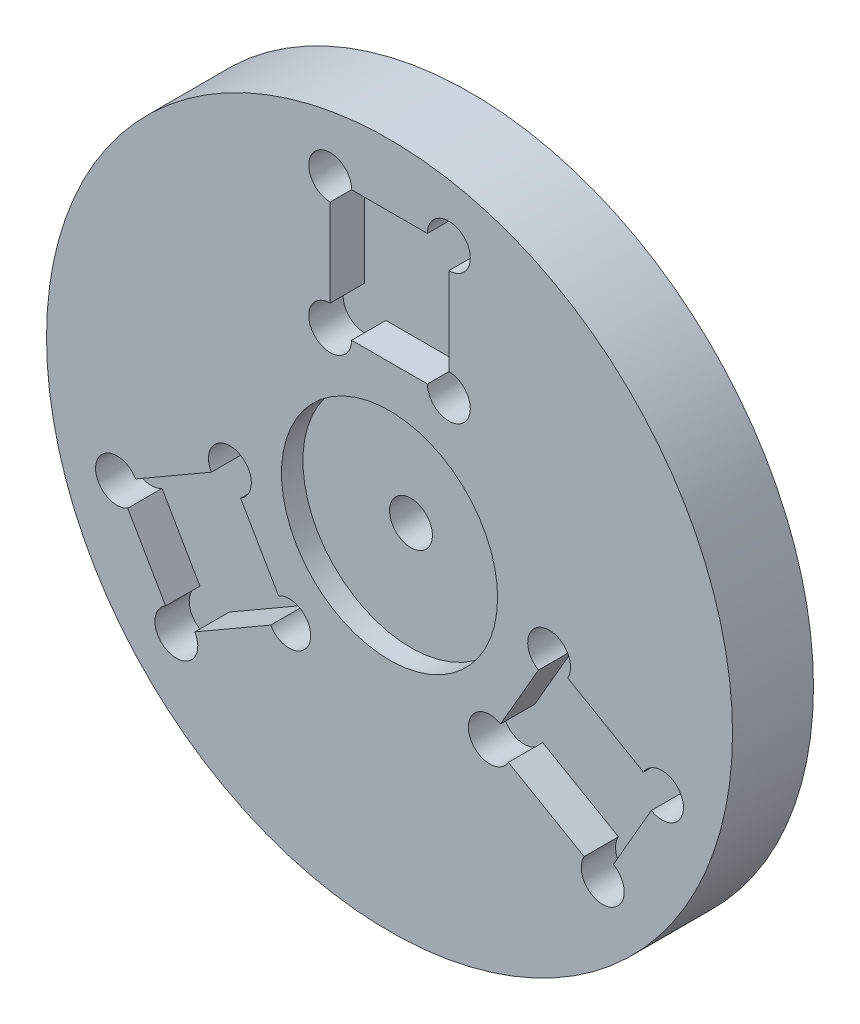
from build123d import *

# Parameters (mm, degrees)
SKETCH1_R            = 50.8
BOSS_EXTRUDE1_DEPTH  = 11.9888
SKETCH3_W            = 17.57426
SKETCH3_H            = 19.304
CUT_EXTRUDE1_DEPTH   = 5.08
SKETCH7_R            = 3.175
CORNER_RELIEFS_DEPTH = 5.08
CIRPATTERN1_COUNT    = 3
SKETCH5_R            = 16.002
MAGNET_INSET_DEPTH   = 3.175
SKETCH6_R            = 3.175
CENTRAL_HOLE_DEPTH   = 73.380681611


with BuildPart() as part:
    # Sketch1 → Boss-Extrude1 (new body)
    with BuildSketch(Plane.XY):
        with Locations(Location((0, 0, 0), (0, 0, 180))):
            Circle(SKETCH1_R)
    extrude(amount=BOSS_EXTRUDE1_DEPTH)

    # Sketch3 → Cut-Extrude1 (cut)
    with BuildSketch(Plane.XY.offset(11.9888)):
        with Locations((0, 31.877)):
            Rectangle(SKETCH3_W, SKETCH3_H)
    cut_extrude1 = extrude(amount=-CUT_EXTRUDE1_DEPTH, mode=Mode.SUBTRACT)

    # Sketch7 → corner reliefs (cut)
    with BuildSketch(Plane.XY.offset(11.9888)):
        with Locations((-8.78713, 41.529)):
            Circle(SKETCH7_R)
        with Locations((-8.78713, 22.225)):
            Circle(SKETCH7_R)
        with Locations((8.78713, 22.225)):
            Circle(SKETCH7_R)
        with Locations((8.78713, 41.529)):
            Circle(SKETCH7_R)
    corner_reliefs = extrude(amount=-CORNER_RELIEFS_DEPTH, mode=Mode.SUBTRACT)

    # CirPattern1: Cut-Extrude1, corner reliefs ×3 about axis
    cirpattern1_axis = Axis((0, 0, 0), (0, 0, 1))
    add([cut_extrude1.rotate(cirpattern1_axis, i * 360 / CIRPATTERN1_COUNT) for i in range(1, CIRPATTERN1_COUNT)], mode=Mode.SUBTRACT)
    add([corner_reliefs.rotate(cirpattern1_axis, i * 360 / CIRPATTERN1_COUNT) for i in range(1, CIRPATTERN1_COUNT)], mode=Mode.SUBTRACT)

    # Sketch5 → magnet inset (cut)
    with BuildSketch(Plane.XY.offset(11.9888)):
        Circle(SKETCH5_R)
    extrude(amount=-MAGNET_INSET_DEPTH, mode=Mode.SUBTRACT)

    # Sketch6 → central hole (cut, through all)
    with BuildSketch(Plane.XY.offset(8.8138)):
        Circle(SKETCH6_R)
    extrude(amount=-CENTRAL_HOLE_DEPTH, mode=Mode.SUBTRACT)


solid = part.part
